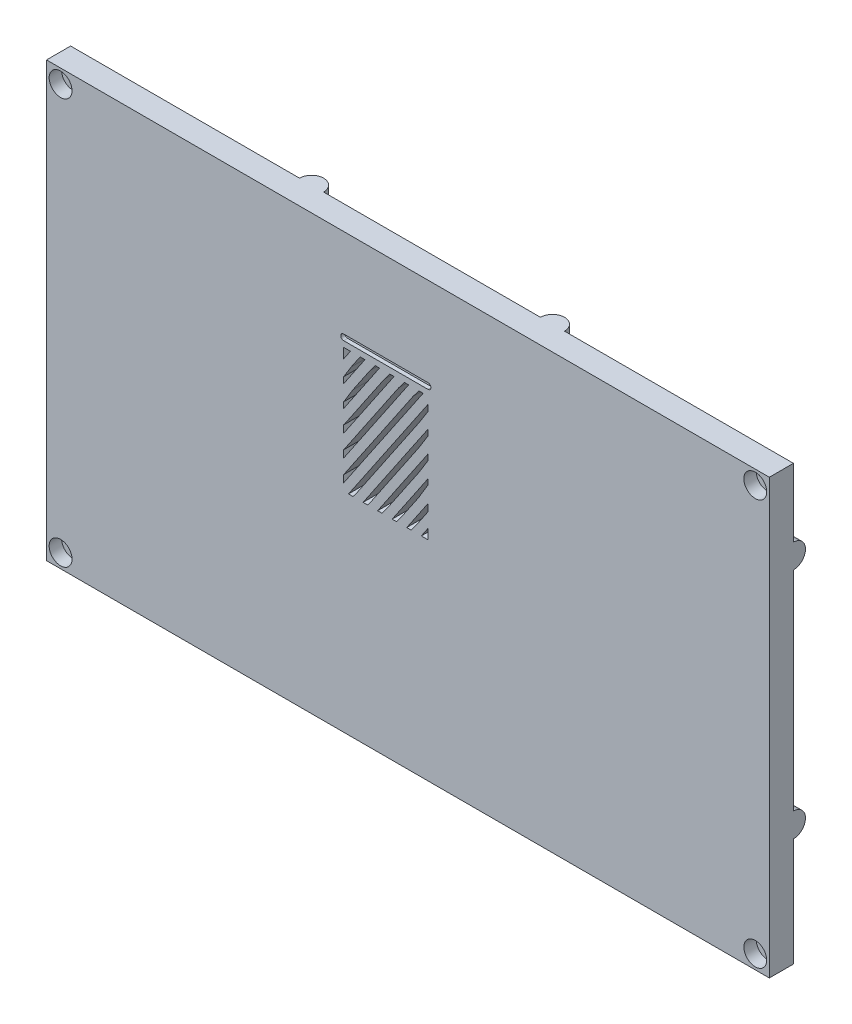
from build123d import *

# Parameters (mm, degrees)
SKETCH_1_W           = 180
SKETCH_1_H           = 108
EXTRUDE_4_DEPTH      = 6
SKETCH_3_R           = 2.85
EXTRUDE_8_DEPTH      = 5.7
SKETCH_4_R           = 2.85
EXTRUDE_9_DEPTH      = 3.1
SKETCH_5_R           = 2.85
CUT_EXTRUDE_1_DEPTH  = 3.1
SKETCH_7_R           = 2.85
CUT_EXTRUDE_2_DEPTH  = 3.1
SKETCH_8_R           = 2.85
CUT_EXTRUDE_3_DEPTH  = 3.1
SKETCH_9_R           = 2.85
CUT_EXTRUDE_4_DEPTH  = 3.1
SKETCH_10_R          = 1.51
CUT_EXTRUDE_5_DEPTH  = 3.1
SKETCH_11_R          = 1.51
CUT_EXTRUDE_6_DEPTH  = 3.1
SKETCH_12_R          = 1.51
CUT_EXTRUDE_7_DEPTH  = 3.1
SKETCH_13_R          = 1.51
CUT_EXTRUDE_8_DEPTH  = 3.1
SKETCH_14_W          = 21
SKETCH_14_H          = 31
CUT_EXTRUDE_10_DEPTH = 10
CUT_EXTRUDE_12_DEPTH = 1
EXTRUDE_10_DEPTH     = 4.4
EXTRUDE_12_DEPTH     = 4.4
SKETCH_18_R          = 3
EXTRUDE_15_DEPTH     = 108
SKETCH_21_R          = 3
EXTRUDE_16_DEPTH     = 180


with BuildPart() as part:
    # 草图1 → 凸台-拉伸4 (new body)
    with BuildSketch(Plane.XY):
        with Locations((22.665747166, 11.024023211)):
            Rectangle(SKETCH_1_W, SKETCH_1_H)
    extrude(amount=EXTRUDE_4_DEPTH)

    # 草图3 → 凸台-拉伸8 (add)
    with BuildSketch(Plane.XY.offset(6)):
        with Locations((109.165747166, 61.524023211)):
            Circle(SKETCH_3_R)
    extrude(amount=-EXTRUDE_8_DEPTH)

    # 草图4 → 凸台-拉伸9 (add)
    with BuildSketch(Plane.XY.offset(6)):
        with Locations((-63.834252834, 61.524023211)):
            Circle(SKETCH_4_R)
    extrude(amount=-EXTRUDE_9_DEPTH)

    # 草图5 → 切除-拉伸1 (cut)
    with BuildSketch(Plane.XY.offset(6)):
        with Locations((-63.834252834, 61.524023211)):
            Circle(SKETCH_5_R)
    extrude(amount=-CUT_EXTRUDE_1_DEPTH, mode=Mode.SUBTRACT)

    # 草图7 → 切除-拉伸2 (cut)
    with BuildSketch(Plane.XY.offset(6)):
        with Locations((109.165747166, 61.524023211)):
            Circle(SKETCH_7_R)
    extrude(amount=-CUT_EXTRUDE_2_DEPTH, mode=Mode.SUBTRACT)

    # 草图8 → 切除-拉伸3 (cut)
    with BuildSketch(Plane.XY.offset(6)):
        with Locations((-63.834252834, -39.475976789)):
            Circle(SKETCH_8_R)
    extrude(amount=-CUT_EXTRUDE_3_DEPTH, mode=Mode.SUBTRACT)

    # 草图9 → 切除-拉伸4 (cut)
    with BuildSketch(Plane.XY.offset(6)):
        with Locations((109.165747166, -39.475976789)):
            Circle(SKETCH_9_R)
    extrude(amount=-CUT_EXTRUDE_4_DEPTH, mode=Mode.SUBTRACT)

    # 草图10 → 切除-拉伸5 (cut)
    with BuildSketch(Plane(origin=(0, 0, 0), x_dir=(-1, 0, 0), z_dir=(0, 0, -1))):
        with Locations((-109.165747166, 61.524023211)):
            Circle(SKETCH_10_R)
    extrude(amount=-CUT_EXTRUDE_5_DEPTH, mode=Mode.SUBTRACT)

    # 草图11 → 切除-拉伸6 (cut)
    with BuildSketch(Plane(origin=(0, 0, 0), x_dir=(-1, 0, 0), z_dir=(0, 0, -1))):
        with Locations((-109.165747166, -39.475976789)):
            Circle(SKETCH_11_R)
    extrude(amount=-CUT_EXTRUDE_6_DEPTH, mode=Mode.SUBTRACT)

    # 草图12 → 切除-拉伸7 (cut)
    with BuildSketch(Plane(origin=(0, 0, 0), x_dir=(-1, 0, 0), z_dir=(0, 0, -1))):
        with Locations((63.834252834, 61.524023211)):
            Circle(SKETCH_12_R)
    extrude(amount=-CUT_EXTRUDE_7_DEPTH, mode=Mode.SUBTRACT)

    # 草图13 → 切除-拉伸8 (cut)
    with BuildSketch(Plane(origin=(0, 0, 0), x_dir=(-1, 0, 0), z_dir=(0, 0, -1))):
        with Locations((63.834252834, -39.475976789)):
            Circle(SKETCH_13_R)
    extrude(amount=-CUT_EXTRUDE_8_DEPTH, mode=Mode.SUBTRACT)

    # 草图14 → 切除-拉伸10 (cut)
    with BuildSketch(Plane.XY.offset(6)):
        with Locations((17.165747166, 24.524023211)):
            Rectangle(SKETCH_14_W, SKETCH_14_H)
    extrude(amount=-CUT_EXTRUDE_10_DEPTH, mode=Mode.SUBTRACT)

    # 草图15 → 切除-拉伸12 (cut)
    with BuildSketch(Plane.XY.offset(6)):
        with BuildLine():
            Line((6.665747166, 42.91898623), (27.665747166, 42.91898623))
            ThreePointArc((27.665747166, 42.91898623), (28.389350728, 42.195382667), (27.665747166, 41.471779105))
            Line((27.665747166, 41.471779105), (6.665747166, 41.471779105))
            ThreePointArc((6.665747166, 41.471779105), (5.942143603, 42.195382667), (6.665747166, 42.91898623))
        make_face()
    extrude(amount=-CUT_EXTRUDE_12_DEPTH, mode=Mode.SUBTRACT)

    # 草图16 → 凸台-拉伸10 (add)
    with BuildSketch(Plane.XY.offset(6)):
        with BuildLine():
            Line((28.493665856, 39.463175066), (7.493665856, 8.463175066))
            ThreePointArc((7.493665856, 8.463175066), (6.104899021, 8.19610452), (5.837828475, 9.584871356))
            Line((5.837828475, 9.584871356), (26.837828475, 40.584871356))
            ThreePointArc((26.837828475, 40.584871356), (28.226595311, 40.851941901), (28.493665856, 39.463175066))
        make_face()
        with BuildLine():
            Line((24.870121619, 39.463175066), (7.493665856, 13.812216559))
            ThreePointArc((7.493665856, 13.812216559), (6.104899021, 13.545146014), (5.837828475, 14.933912849))
            Line((5.837828475, 14.933912849), (23.214284238, 40.584871356))
            ThreePointArc((23.214284238, 40.584871356), (24.603051073, 40.851941901), (24.870121619, 39.463175066))
        make_face()
        with BuildLine():
            Line((21.246577381, 39.463175066), (7.493665856, 19.161258052))
            ThreePointArc((7.493665856, 19.161258052), (6.104899021, 18.894187507), (5.837828475, 20.282954343))
            Line((5.837828475, 20.282954343), (19.59074, 40.584871356))
            ThreePointArc((19.59074, 40.584871356), (20.979506836, 40.851941901), (21.246577381, 39.463175066))
        make_face()
        with BuildLine():
            Line((17.623033144, 39.463175066), (7.493665856, 24.510299546))
            ThreePointArc((7.493665856, 24.510299546), (6.104899021, 24.243229001), (5.837828475, 25.631995836))
            Line((5.837828475, 25.631995836), (15.967195763, 40.584871356))
            ThreePointArc((15.967195763, 40.584871356), (17.355962599, 40.851941901), (17.623033144, 39.463175066))
        make_face()
        with BuildLine():
            Line((13.975285013, 39.427445509), (7.493665856, 29.859341039))
            ThreePointArc((7.493665856, 29.859341039), (6.104899021, 29.592270494), (5.837828475, 30.98103733))
            Line((5.837828475, 30.98103733), (12.319447632, 40.549141799))
            ThreePointArc((12.319447632, 40.549141799), (13.708214468, 40.816212345), (13.975285013, 39.427445509))
        make_face()
        with BuildLine():
            Line((10.375944669, 39.463175066), (7.493665856, 35.208382533))
            ThreePointArc((7.493665856, 35.208382533), (6.104899021, 34.941311987), (5.837828475, 36.330078823))
            Line((5.837828475, 36.330078823), (8.720107288, 40.584871356))
            ThreePointArc((8.720107288, 40.584871356), (10.108874124, 40.851941901), (10.375944669, 39.463175066))
        make_face()
        with BuildLine():
            Line((28.493665856, 34.114133572), (11.117210094, 8.463175066))
            ThreePointArc((11.117210094, 8.463175066), (9.728443258, 8.19610452), (9.461372713, 9.584871356))
            Line((9.461372713, 9.584871356), (26.837828475, 35.235829863))
            ThreePointArc((26.837828475, 35.235829863), (28.226595311, 35.502900408), (28.493665856, 34.114133572))
        make_face()
        with BuildLine():
            Line((28.493665856, 28.765092079), (14.740754331, 8.463175066))
            ThreePointArc((14.740754331, 8.463175066), (13.351987496, 8.19610452), (13.08491695, 9.584871356))
            Line((13.08491695, 9.584871356), (26.837828475, 29.886788369))
            ThreePointArc((26.837828475, 29.886788369), (28.226595311, 30.153858915), (28.493665856, 28.765092079))
        make_face()
        with BuildLine():
            Line((28.493665856, 18.067009092), (21.839365483, 8.243994256))
            ThreePointArc((21.839365483, 8.243994256), (20.450598648, 7.976923711), (20.183528102, 9.365690546))
            Line((20.183528102, 9.365690546), (26.837828475, 19.188705383))
            ThreePointArc((26.837828475, 19.188705383), (28.226595311, 19.455775928), (28.493665856, 18.067009092))
        make_face()
        with BuildLine():
            Line((28.493665856, 12.717967599), (25.611387044, 8.463175066))
            ThreePointArc((25.611387044, 8.463175066), (24.222620208, 8.19610452), (23.955549663, 9.584871356))
            Line((23.955549663, 9.584871356), (26.837828475, 13.839663889))
            ThreePointArc((26.837828475, 13.839663889), (28.226595311, 14.106734434), (28.493665856, 12.717967599))
        make_face()
        with BuildLine():
            Line((28.493665856, 23.416050586), (18.364298569, 8.463175066))
            ThreePointArc((18.364298569, 8.463175066), (16.975531733, 8.19610452), (16.708461188, 9.584871356))
            Line((16.708461188, 9.584871356), (26.837828475, 24.537746876))
            ThreePointArc((26.837828475, 24.537746876), (28.226595311, 24.804817421), (28.493665856, 23.416050586))
        make_face()
    extrude(amount=-EXTRUDE_10_DEPTH)

    # 草图17 → 凸台-拉伸12 (add)
    with BuildSketch(Plane.XY.offset(6)):
        Polygon((9.291077122, 41.427731587), (10.946914503, 40.306035296), (9.559645246, 38.258161632), (7.903807865, 39.379857922), align=None)
        Polygon((13.049495166, 41.419687565), (14.652090321, 40.219395608), (13.183189483, 38.258161632), (11.580594328, 39.458453588), align=None)
        Polygon((16.598688708, 41.312908479), (18.201283863, 40.112616523), (16.753491495, 38.179565965), (15.15089634, 39.379857922), align=None)
        Polygon((23.799395039, 41.251005631), (25.404854584, 40.05494206), (23.929168948, 38.074149695), (22.323709403, 39.270213267), align=None)
        Polygon((20.294085137, 41.416455751), (21.899544682, 40.220392179), (20.356002546, 38.148516976), (18.750543001, 39.344580548), align=None)
        Polygon((27.059349697, 31.996809719), (29.592825756, 35.991789111), (27.903049923, 37.063385782), (25.369573865, 33.06840639), align=None)
        Polygon((27.059349697, 26.647768225), (29.657516879, 30.835687648), (27.956643474, 31.890902187), (25.358476292, 27.702982765), align=None)
        Polygon((27.059349697, 21.298726732), (29.809729018, 25.762891731), (28.105364864, 26.812953261), (25.354985543, 22.348788261), align=None)
        Polygon((27.059349697, 15.949685239), (29.875638884, 20.653316626), (28.157020256, 21.682335837), (25.340731069, 16.97870445), align=None)
        Polygon((27.400761437, 11.104632504), (30.093714703, 15.079944467), (28.437877322, 16.201640757), (25.744924056, 12.226328794), align=None)
        Polygon((24.34904045, 6.839114616), (22.743580905, 8.035178188), (24.531450984, 10.435011402), (26.136910529, 9.23894783), align=None)
        Polygon((20.616325121, 6.692575775), (19.010865576, 7.888639346), (20.907906746, 10.435011402), (22.513366292, 9.23894783), align=None)
        Polygon((17.217009332, 6.999947538), (15.611549786, 8.196011109), (17.33210575, 10.505489519), (18.937565295, 9.309425947), align=None)
        Polygon((13.752364906, 7.191393443), (12.14690536, 8.387457015), (13.545436794, 10.264686364), (15.15089634, 9.068622793), align=None)
        Polygon((10.142404174, 7.231469503), (8.536944628, 8.427533074), (10.085017275, 10.505489519), (11.69047682, 9.309425947), align=None)
        Polygon((7.407914057, 17.251658231), (4.395376532, 12.804579029), (6.051213913, 11.682882738), (9.063751438, 16.129961941), align=None)
        Polygon((7.235662462, 22.346423561), (4.352783087, 18.090744484), (6.008620468, 16.969048193), (8.891499842, 21.22472727), align=None)
        Polygon((7.235662462, 27.695465054), (5.052244478, 24.472324221), (6.708081859, 23.35062793), (8.891499842, 26.573768764), align=None)
        Polygon((7.235662462, 33.044506547), (4.876433622, 29.202971295), (6.582399671, 28.155274467), (8.94162851, 31.996809719), align=None)
        Polygon((6.83097858, 37.796157549), (8.536944628, 36.74846072), (6.3595402, 33.202990382), (4.653574152, 34.250687211), align=None)
    extrude(amount=-EXTRUDE_12_DEPTH)

    # 草图18 → 凸台-拉伸15 (add)
    with BuildSketch(Plane(origin=(0, 65.024023211, 0), x_dir=(1, 0, 0), z_dir=(0, 1, 0))):
        with Locations((-7.334252834, 0)):
            Circle(SKETCH_18_R)
        with Locations((52.665747166, 0)):
            Circle(SKETCH_18_R)
    extrude(amount=-EXTRUDE_15_DEPTH)

    # 草图21 → 凸台-拉伸16 (add)
    with BuildSketch(Plane(origin=(112.665747166, 0, 0), x_dir=(0, 0, -1), z_dir=(1, 0, 0))):
        with Locations((0, -12.975976789)):
            Circle(SKETCH_21_R)
        with Locations((0, 45.024023211)):
            Circle(SKETCH_21_R)
    extrude(amount=-EXTRUDE_16_DEPTH)


solid = part.part
